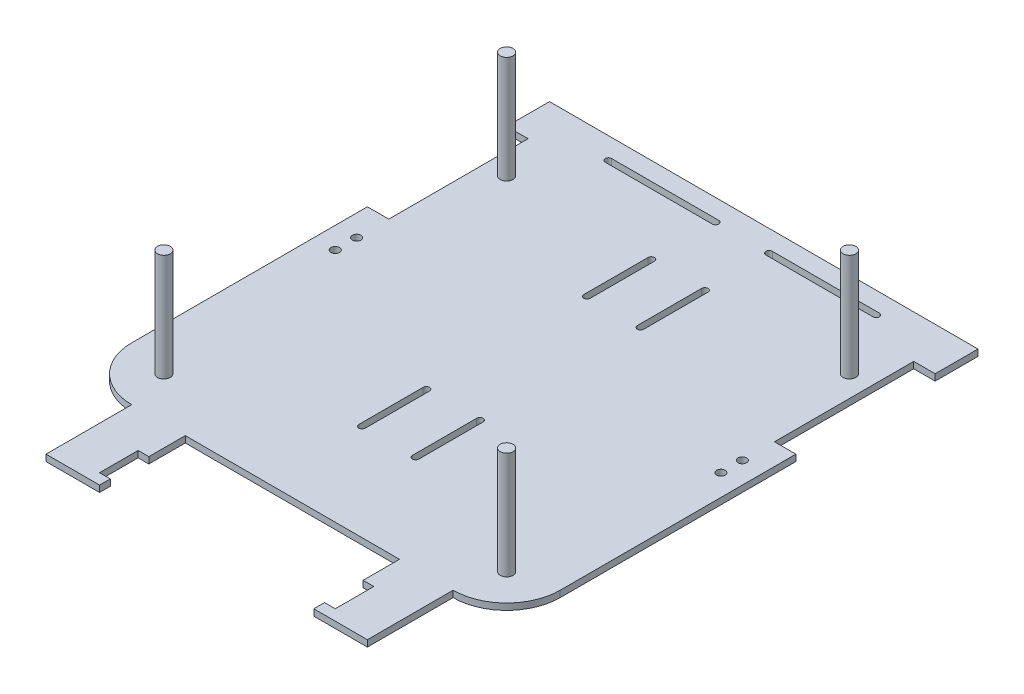
from build123d import *

# Parameters (mm, degrees)
SKETCH1_R           = 2
BOSS_EXTRUDE1_DEPTH = 3
SKETCH2_R           = 3
BOSS_EXTRUDE2_DEPTH = 50
SKETCH3_R           = 3.8
BOSS_EXTRUDE3_DEPTH = 30
SKETCH1_3_W         = 25
SKETCH1_3_H         = 40
BOSS_EXTRUDE4_DEPTH = 3
SKETCH4_W           = 5
SKETCH4_H           = 18
CUT_EXTRUDE1_DEPTH  = 10


with BuildPart() as part:
    # Sketch1 → Boss-Extrude1 (new body)
    with BuildSketch(Plane(origin=(0, 0, 0), x_dir=(1, 0, 0), z_dir=(0, 1, 0))):
        with BuildLine():
            ThreePointArc((-100, 25), (-92.67766953, 7.32233047), (-75, 0))
            Line((-75, 0), (-50, 0))
            Line((-50, 0), (50, 0))
            Line((50, 0), (75, 0))
            ThreePointArc((75, 0), (92.67766953, 7.32233047), (100, 25))
            Line((100, 25), (100, 135))
            Line((100, 135), (90, 135))
            Line((90, 135), (90, 200))
            Line((90, 200), (100, 200))
            Line((100, 200), (100, 220))
            Line((100, 220), (-100, 220))
            Line((-100, 220), (-100, 200))
            Line((-100, 200), (-90, 200))
            Line((-90, 200), (-90, 135))
            Line((-90, 135), (-100, 135))
            Line((-100, 135), (-100, 25))
        make_face()
        with BuildLine():
            Line((-14, 45), (-14, 75))
            ThreePointArc((-14, 75), (-12.5, 76.5), (-11, 75))
            Line((-11, 75), (-11, 45))
            ThreePointArc((-11, 45), (-12.5, 43.5), (-14, 45))
        make_face(mode=Mode.SUBTRACT)
        with BuildLine():
            ThreePointArc((11, 75), (12.5, 76.5), (14, 75))
            Line((14, 75), (14, 45))
            ThreePointArc((14, 45), (12.5, 43.5), (11, 45))
            Line((11, 45), (11, 75))
        make_face(mode=Mode.SUBTRACT)
        with Locations((-90, 110)):
            Circle(SKETCH1_R, mode=Mode.SUBTRACT)
        with Locations((-90, 120)):
            Circle(SKETCH1_R, mode=Mode.SUBTRACT)
        with BuildLine():
            Line((-14, 150), (-14, 180))
            ThreePointArc((-14, 180), (-12.5, 181.5), (-11, 180))
            Line((-11, 180), (-11, 150))
            ThreePointArc((-11, 150), (-12.5, 148.5), (-14, 150))
        make_face(mode=Mode.SUBTRACT)
        with BuildLine():
            Line((-62.5, 211.5), (-12.5, 211.5))
            ThreePointArc((-12.5, 211.5), (-11, 210), (-12.5, 208.5))
            Line((-12.5, 208.5), (-62.5, 208.5))
            ThreePointArc((-62.5, 208.5), (-64, 210), (-62.5, 211.5))
        make_face(mode=Mode.SUBTRACT)
        with Locations((90, 110)):
            Circle(SKETCH1_R, mode=Mode.SUBTRACT)
        with Locations((90, 120)):
            Circle(SKETCH1_R, mode=Mode.SUBTRACT)
        with BuildLine():
            ThreePointArc((11, 180), (12.5, 181.5), (14, 180))
            Line((14, 180), (14, 150))
            ThreePointArc((14, 150), (12.5, 148.5), (11, 150))
            Line((11, 150), (11, 180))
        make_face(mode=Mode.SUBTRACT)
        with BuildLine():
            ThreePointArc((12.5, 208.5), (11, 210), (12.5, 211.5))
            Line((12.5, 211.5), (62.5, 211.5))
            ThreePointArc((62.5, 211.5), (64, 210), (62.5, 208.5))
            Line((62.5, 208.5), (12.5, 208.5))
        make_face(mode=Mode.SUBTRACT)
    extrude(amount=BOSS_EXTRUDE1_DEPTH)

    # Sketch2 → Boss-Extrude2 (add)
    with BuildSketch(Plane(origin=(0, 3, 0), x_dir=(1, 0, 0), z_dir=(0, 1, 0))):
        with Locations((-80, 20)):
            Circle(SKETCH2_R)
        with Locations((80, 20)):
            Circle(SKETCH2_R)
        with Locations((-80, 180)):
            Circle(SKETCH2_R)
        with Locations((80, 180)):
            Circle(SKETCH2_R)
    extrude(amount=BOSS_EXTRUDE2_DEPTH)

    # Sketch3 → Boss-Extrude3 (add)
    with BuildSketch(Plane(origin=(0, 0, 0), x_dir=(1, 0, 0), z_dir=(0, 1, 0))):
        with Locations((-43.4, 50)):
            Circle(SKETCH3_R)
        with Locations((43.4, 50)):
            Circle(SKETCH3_R)
    extrude(amount=-BOSS_EXTRUDE3_DEPTH)

    # Sketch1<3> → Boss-Extrude4 (add)
    with BuildSketch(Plane(origin=(0, 0, 0), x_dir=(1, 0, 0), z_dir=(0, 1, 0))):
        with Locations((-62.5, -20)):
            Rectangle(SKETCH1_3_W, SKETCH1_3_H)
        with Locations((62.5, -20)):
            Rectangle(SKETCH1_3_W, SKETCH1_3_H)
    extrude(amount=BOSS_EXTRUDE4_DEPTH)

    # Sketch4 → Cut-Extrude1 (cut)
    with BuildSketch(Plane(origin=(0, 3, 0), x_dir=(1, 0, 0), z_dir=(0, 1, 0))):
        with Locations((-52.5, -26)):
            Rectangle(SKETCH4_W, SKETCH4_H)
        with Locations((52.5, -26)):
            Rectangle(SKETCH4_W, SKETCH4_H)
    extrude(amount=-CUT_EXTRUDE1_DEPTH, mode=Mode.SUBTRACT)


solid = part.part
